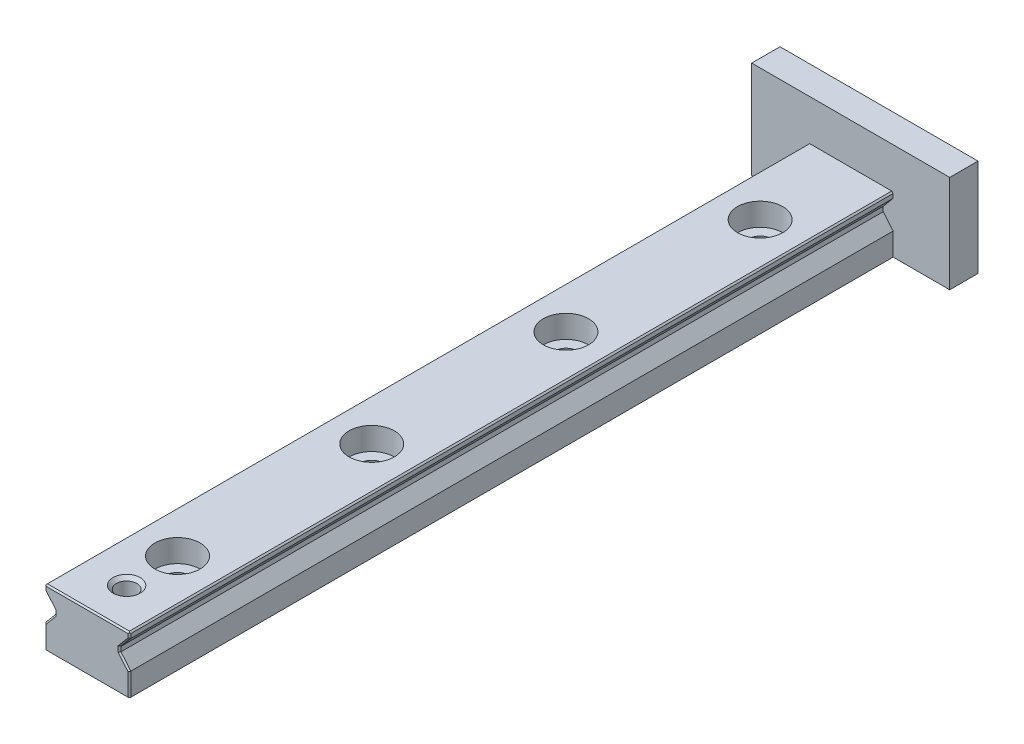
from build123d import *

# Parameters (mm, degrees)
P_IDAT_VYSUNUT_M1_DEPTH  = 140
SKICA2_W                 = 35
SKICA2_H                 = 17.21
P_IDAT_VYSUNUT_M2_DEPTH  = 5
SKICA3_R                 = 2.1
ODEBRAT_VYSUNUT_M1_DEPTH = 10
SKICA4_R                 = 4
ODEBRAT_VYSUNUT_M2_DEPTH = 4
SKICA5_R                 = 1.8
ODEBRAT_VYSUNUT_M3_DEPTH = 10
ZKOSEN_2_SIZE            = 0.25
ZKOSEN_3_SIZE            = 0.25
ZKOSEN_4_SIZE            = 0.6


with BuildPart() as part:
    # Skica1 → Přidat vysunutím1 (new body)
    with BuildSketch(Plane.XY):
        Polygon((0, 9), (1.749522731, 6.915), (1.749522731, 6.085), (0, 4), (0, 0), (15, 0), (15, 4), (13.250477269, 6.085), (13.250477269, 6.915), (15, 9), (15, 10), (0, 10), align=None)
    extrude(amount=P_IDAT_VYSUNUT_M1_DEPTH)

    # Skica2 → Přidat vysunutím2 (add)
    with BuildSketch(Plane(origin=(0, 0, 0), x_dir=(-1, 0, 0), z_dir=(0, 0, -1))):
        with Locations((-7.5, 8.605)):
            Rectangle(SKICA2_W, SKICA2_H)
    extrude(amount=-P_IDAT_VYSUNUT_M2_DEPTH)

    # Skica3 → Odebrat vysunutím1 (cut)
    with BuildSketch(Plane(origin=(0, 10, 0), x_dir=(1, 0, 0), z_dir=(0, 1, 0))):
        with Locations(Location((7.5, -124, 0), (0, 0, 180))):
            Circle(SKICA3_R)
        with Locations(Location((7.5, -89.666666667, 0), (0, 0, 180))):
            Circle(SKICA3_R)
        with Locations(Location((7.5, -55.333333333, 0), (0, 0, 180))):
            Circle(SKICA3_R)
        with Locations(Location((7.5, -21, 0), (0, 0, 180))):
            Circle(SKICA3_R)
    extrude(amount=-ODEBRAT_VYSUNUT_M1_DEPTH, mode=Mode.SUBTRACT)

    # Skica4 → Odebrat vysunutím2 (cut)
    with BuildSketch(Plane(origin=(0, 10, 0), x_dir=(1, 0, 0), z_dir=(0, 1, 0))):
        with Locations(Location((7.5, -124, 0), (0, 0, 180))):
            Circle(SKICA4_R)
        with Locations(Location((7.5, -89.67, 0), (0, 0, 180))):
            Circle(SKICA4_R)
        with Locations(Location((7.5, -55.34, 0), (0, 0, 180))):
            Circle(SKICA4_R)
        with Locations(Location((7.5, -21.01, 0), (0, 0, 180))):
            Circle(SKICA4_R)
    extrude(amount=-ODEBRAT_VYSUNUT_M2_DEPTH, mode=Mode.SUBTRACT)

    # Skica5 → Odebrat vysunutím3 (cut)
    with BuildSketch(Plane(origin=(0, 10, 0), x_dir=(1, 0, 0), z_dir=(0, 1, 0))):
        with Locations(Location((7.5, -133, 0), (0, 0, 180))):
            Circle(SKICA5_R)
    extrude(amount=-ODEBRAT_VYSUNUT_M3_DEPTH, mode=Mode.SUBTRACT)

    # Zkosení2
    zkosen_2_edges = [part.edges().sort_by_distance(p)[0] for p in [
        (15, 2, 140),
        (14.125238634, 5.0425, 140),
        (13.250477269, 6.5, 140),
        (14.125238634, 7.9575, 140),
        (15, 9.5, 140),
        (7.5, 10, 140),
        (0, 9.5, 140),
        (0.874761366, 7.9575, 140),
        (1.749522731, 6.5, 140),
        (0.874761366, 5.0425, 140),
        (0, 2, 140),
    ]]
    chamfer(zkosen_2_edges, length=ZKOSEN_2_SIZE)

    # Zkosení3
    zkosen_3_edges = [part.edges().sort_by_distance(p)[0] for p in [
        (15, 10, 72.375),
        (0, 10, 72.375),
    ]]
    chamfer(zkosen_3_edges, length=ZKOSEN_3_SIZE)

    # Zkosení4
    zkosen_4_edges = [part.edges().sort_by_distance(p)[0] for p in [
        (9.3, 10, 133),
    ]]
    chamfer(zkosen_4_edges, length=ZKOSEN_4_SIZE)


solid = part.part
